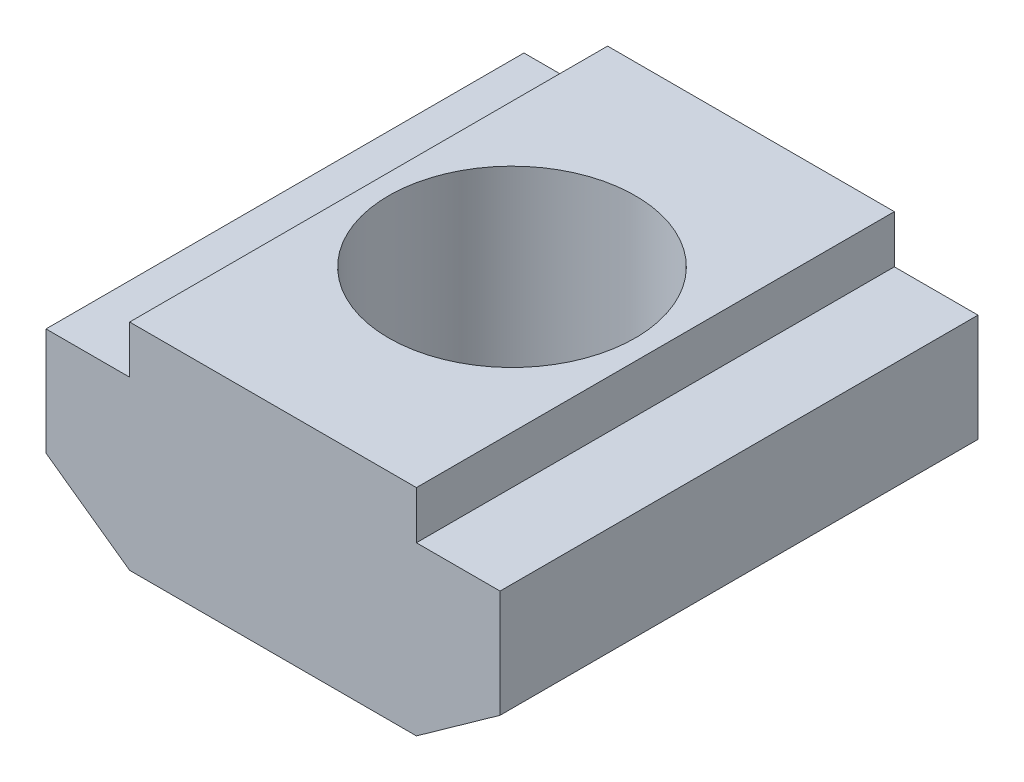
from build123d import *

# Parameters (mm, degrees)
EXTRUDE_1_DEPTH     = 10
CUT_EXTRUDE_1_REACH = 13.95
SKETCH_2_R          = 2.58


with BuildPart() as part:
    # 草图1 → 凸台-拉伸1 (new body)
    with BuildSketch(Plane.XY):
        Polygon((-3, 0), (3, 0), (3, -1), (4.75, -1), (4.75, -3.251737131), (3, -4.5), (-3, -4.5), (-4.75, -3.251737131), (-4.75, -1), (-3, -1), align=None)
    extrude(amount=EXTRUDE_1_DEPTH)

    # 草图2 → 切除-拉伸1 (cut, up to next)
    with BuildSketch(Plane(origin=(0, 0, 0), x_dir=(1, 0, 0), z_dir=(0, 1, 0)), mode=Mode.PRIVATE) as cut_extrude_1_sk1:
        with Locations(Location((0, -5, 0), (0, 0, 270))):
            Circle(SKETCH_2_R)
    cut_extrude_1_tool1 = extrude(cut_extrude_1_sk1.sketch, amount=-CUT_EXTRUDE_1_REACH, mode=Mode.PRIVATE) & part.part
    add(cut_extrude_1_tool1.solids().sort_by_distance((0, 0, 5))[0], mode=Mode.SUBTRACT)


solid = part.part
